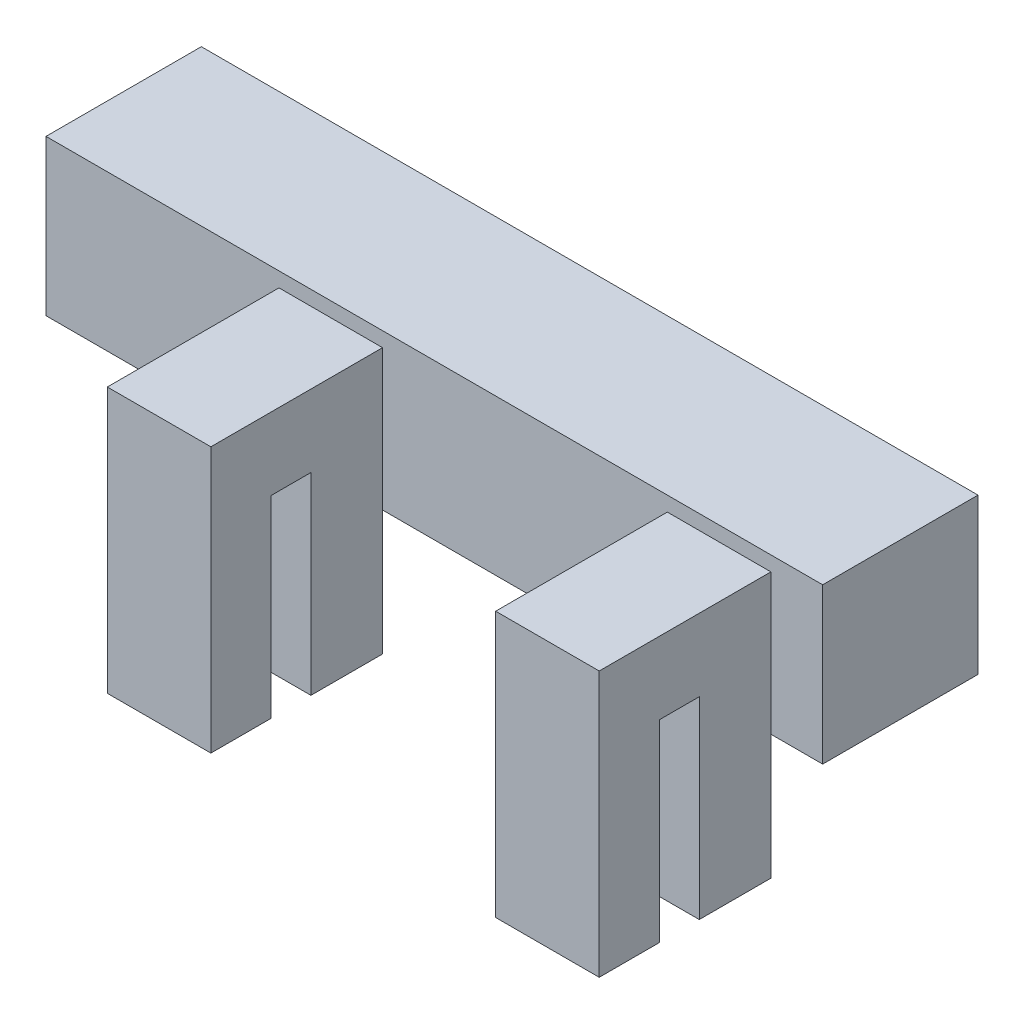
from build123d import *

# Parameters (mm, degrees)
ESQUISSE1_W                = 150
ESQUISSE1_H                = 30
BOSS_EXTRU_1_DEPTH         = 30
BOSS_EXTRU_2_START         = -45
BOSS_EXTRU_2_DEPTH         = 20
R_P_TITION_LIN_AIRE1_COUNT = 2
R_P_TITION_LIN_AIRE1_PITCH = 75


with BuildPart() as part:
    # Esquisse1 → Boss.-Extru.1 (new body)
    with BuildSketch(Plane.XY):
        with Locations((-75, 15)):
            Rectangle(ESQUISSE1_W, ESQUISSE1_H)
    extrude(amount=BOSS_EXTRU_1_DEPTH)

    # Esquisse2 → Boss.-Extru.2 (add)
    with BuildSketch(Plane.ZY.offset(150).offset(BOSS_EXTRU_2_START)):
        Polygon((30, 27.158170339), (63.156193336, 27.158170339), (63.156193336, -24.079833233), (51.504613428, -24.079833233), (51.504613428, 13.190748461), (43.833386904, 13.190748461), (43.833386904, -24.079833233), (30, -24.079833233), align=None)
    boss_extru_2 = extrude(amount=-BOSS_EXTRU_2_DEPTH)

    # Répétition linéaire1: Boss.-Extru.2 ×2
    with Locations(*[(i * R_P_TITION_LIN_AIRE1_PITCH, 0, 0) for i in range(1, R_P_TITION_LIN_AIRE1_COUNT)]):
        add(boss_extru_2)


solid = part.part
